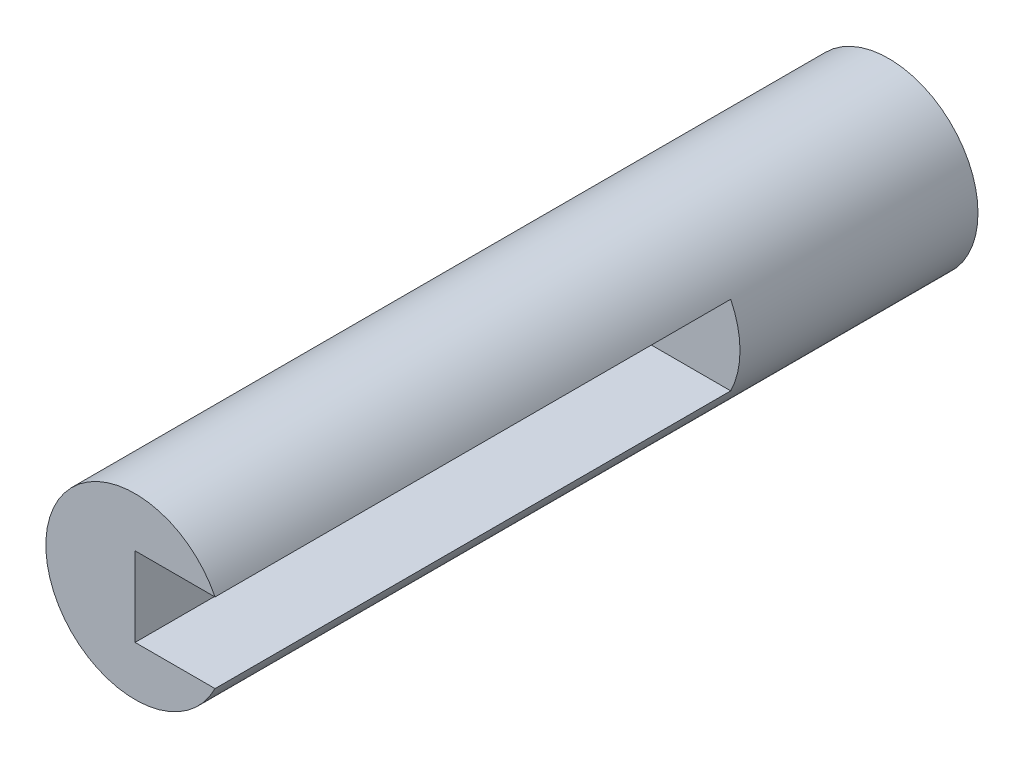
from build123d import *

# Parameters (mm, degrees)
SKETCH1_R           = 4.5
BOSS_EXTRUDE3_DEPTH = 38
CUT_EXTRUDE2_DEPTH  = 1.5
CUT_EXTRUDE3_DEPTH  = 7.5
SKETCH6_W           = 7.945575041
SKETCH6_H           = 4
CUT_EXTRUDE4_DEPTH  = 26


with BuildPart() as part:
    # Sketch1 → Boss-Extrude3 (new body)
    with BuildSketch(Plane.XY):
        with Locations((-11.304886055, 8.134003381)):
            Circle(SKETCH1_R)
    extrude(amount=BOSS_EXTRUDE3_DEPTH)

    # Sketch3 → Cut-Extrude2 (cut)
    with BuildSketch(Plane.XY):
        with BuildLine():
            Line((-13.304886055, 9.634003381), (-9.304886055, 9.634003381))
            ThreePointArc((-9.304886055, 9.634003381), (-11.304886055, 10.634003381), (-13.304886055, 9.634003381))
        make_face()
        with BuildLine():
            Line((-9.304886055, 6.634003381), (-13.304886055, 6.634003381))
            ThreePointArc((-13.304886055, 6.634003381), (-11.304886055, 5.634003381), (-9.304886055, 6.634003381))
        make_face()
    extrude(amount=CUT_EXTRUDE2_DEPTH, mode=Mode.SUBTRACT)

    # Sketch3<4> → Cut-Extrude3 (cut)
    with BuildSketch(Plane.XY):
        with BuildLine():
            ThreePointArc((-8.804886055, 8.134003381), (-8.93317781, 8.924572796), (-9.304886055, 9.634003381))
            Line((-9.304886055, 9.634003381), (-13.304886055, 9.634003381))
            ThreePointArc((-13.304886055, 9.634003381), (-13.804886055, 8.134003381), (-13.304886055, 6.634003381))
            Line((-13.304886055, 6.634003381), (-9.304886055, 6.634003381))
            ThreePointArc((-9.304886055, 6.634003381), (-8.93317781, 7.343433966), (-8.804886055, 8.134003381))
        make_face()
    extrude(amount=CUT_EXTRUDE3_DEPTH, mode=Mode.SUBTRACT)

    # Sketch6 → Cut-Extrude4 (cut)
    with BuildSketch(Plane.XY.offset(38)):
        with Locations((-7.332098535, 8.134003381)):
            Rectangle(SKETCH6_W, SKETCH6_H)
    extrude(amount=-CUT_EXTRUDE4_DEPTH, mode=Mode.SUBTRACT)


solid = part.part
